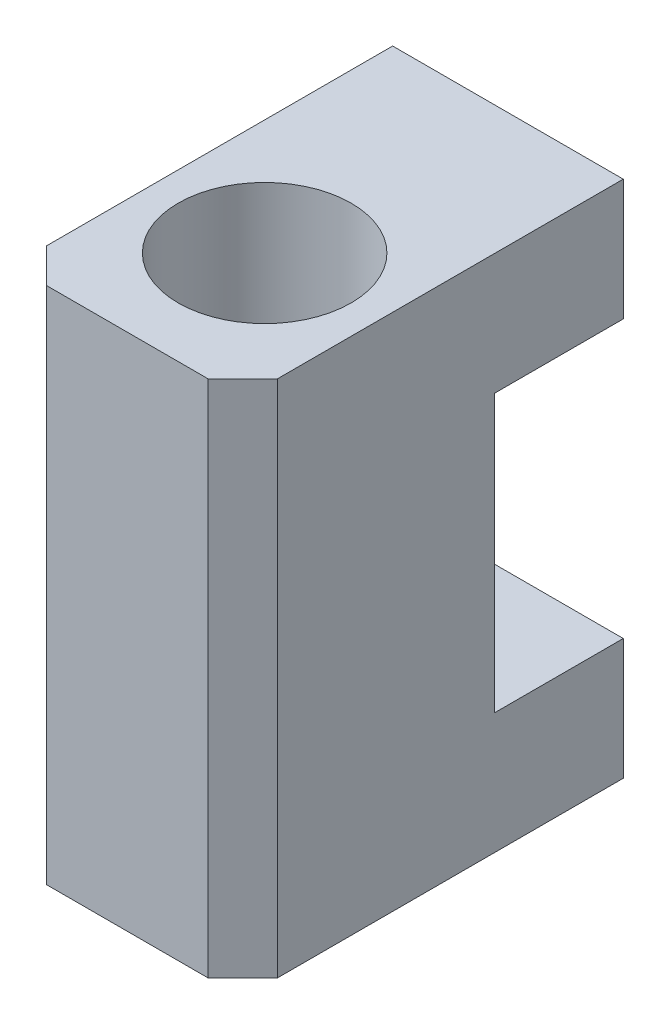
from build123d import *

# Parameters (mm, degrees)
SCHIZZO1_W                   = 20
SCHIZZO1_H                   = 45
ESTRUSIONE_ESTRUSIONE1_DEPTH = 33
SCHIZZO2_R                   = 7.5
TAGLIO_ESTRUSIONE1_DEPTH     = 60.279001341
FORO_4_0_4_1_D               = 4
FORO_4_0_4_1_DEPTH           = 10
FORO_4_0_4_1_TIP             = 1.201721238
SMUSSO1_SIZE                 = 3
SCHIZZO7_W                   = 11.145993212
SCHIZZO7_H                   = 24
TAGLIO_ESTRUSIONE4_DEPTH     = 26


with BuildPart() as part:
    # Schizzo1 → Estrusione-Estrusione1 (new body)
    with BuildSketch(Plane.XY):
        with Locations((10, 22.5)):
            Rectangle(SCHIZZO1_W, SCHIZZO1_H)
    extrude(amount=-ESTRUSIONE_ESTRUSIONE1_DEPTH)

    # Schizzo2 → Taglio-Estrusione1 (cut, through all)
    with BuildSketch(Plane.XZ):
        with Locations((10, -11.9)):
            Circle(SCHIZZO2_R)
    extrude(amount=-TAGLIO_ESTRUSIONE1_DEPTH, mode=Mode.SUBTRACT)

    # Foro Ø4.0 (4)-1
    with Locations(Plane(origin=(10, 6, -33), x_dir=(-1, 0, 0), z_dir=(0, 0, -1))):
        with Locations((0, 0), (0, 33)):
            Hole(FORO_4_0_4_1_D / 2, depth=FORO_4_0_4_1_DEPTH)
            with Locations((0, 0, -(FORO_4_0_4_1_DEPTH + FORO_4_0_4_1_TIP / 2))):  # 118° drill point
                Cone(0, FORO_4_0_4_1_D / 2, FORO_4_0_4_1_TIP, mode=Mode.SUBTRACT)

    # Smusso1
    smusso1_edges = [part.edges().sort_by_distance(p)[0] for p in [
        (0, 22.5, 0),
        (20, 22.5, 0),
    ]]
    chamfer(smusso1_edges, length=SMUSSO1_SIZE)

    # Schizzo7 → Taglio-Estrusione4 (cut)
    with BuildSketch(Plane.ZY):
        with Locations((-27.427003394, 22.5)):
            Rectangle(SCHIZZO7_W, SCHIZZO7_H)
    extrude(amount=-TAGLIO_ESTRUSIONE4_DEPTH, mode=Mode.SUBTRACT)


solid = part.part
